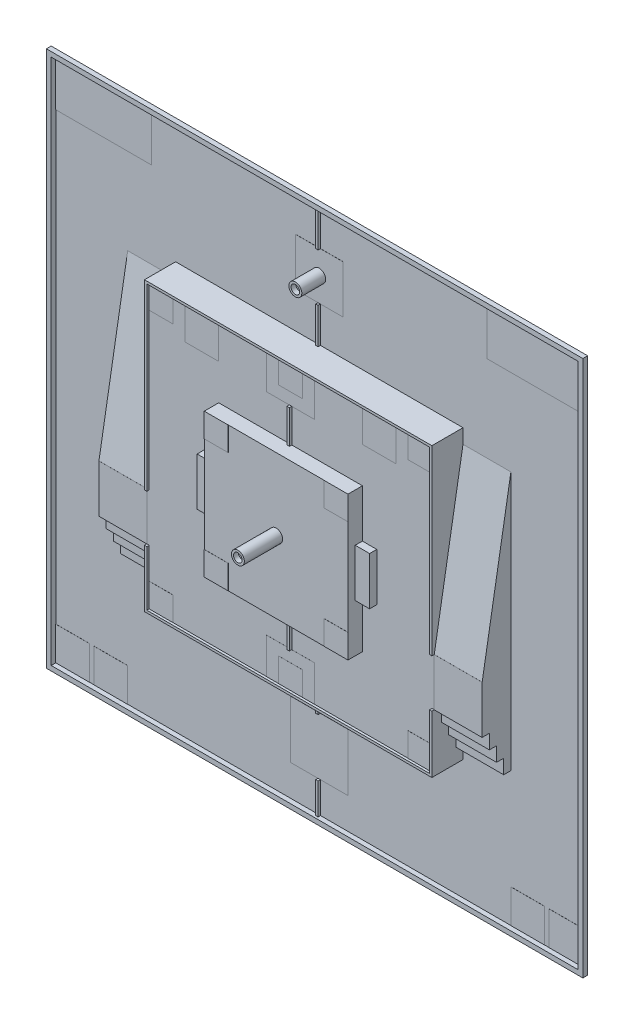
from build123d import *

# Parameters (mm, degrees)
SKETCH_1_W          = 11000
SKETCH_1_H          = 11000
EXTRUDE_1_DEPTH     = 2
SKETCH_2_W          = 700
SKETCH_2_H          = 700
SKETCH_2_W_2        = 2000
SKETCH_2_H_2        = 1000
SKETCH_2_W_3        = 1200
SKETCH_2_H_3        = 1200
SKETCH_2_W_4        = 1000
EXTRUDE_2_DEPTH     = 2
SKETCH_3_W          = 6000
SKETCH_3_H          = 6000
EXTRUDE_3_DEPTH     = 600
EXTRUDE_4_DEPTH     = 1000
SKETCH_5_W          = 3000
SKETCH_5_H          = 3000
EXTRUDE_5_DEPTH     = 300
SKETCH_6_R          = 135
EXTRUDE_6_DEPTH     = 800
SKETCH_7_R          = 90
CUT_EXTRUDE_1_DEPTH = 100
SKETCH_8_W          = 300
SKETCH_8_H          = 1000
EXTRUDE_7_DEPTH     = 150
SKETCH_9_W          = 500
SKETCH_9_H          = 500
EXTRUDE_8_DEPTH     = 2
SKETCH_10_W         = 11200
SKETCH_10_H         = 11200
SKETCH_10_W_2       = 11000
SKETCH_10_H_2       = 11000
EXTRUDE_9_DEPTH     = 100
SKETCH_12_R         = 135
EXTRUDE_10_DEPTH    = 500
SKETCH_13_R         = 90
CUT_EXTRUDE_2_DEPTH = 100
SKETCH_14_W         = 50
SKETCH_14_H         = 650
SKETCH_14_H_2       = 750
EXTRUDE_11_DEPTH    = 50
SKETCH_15_W         = 50
SKETCH_15_H         = 700
EXTRUDE_12_DEPTH    = 50
SKETCH_16_W         = 500
SKETCH_16_H         = 500
SKETCH_16_W_2       = 700
SKETCH_16_H_2       = 700
EXTRUDE_13_DEPTH    = 2
SKETCH_17_W         = 1000
SKETCH_17_H         = 750
EXTRUDE_14_DEPTH    = 1
SKETCH_18_W         = 1000.1
SKETCH_18_H         = 1000.1
EXTRUDE_21_DEPTH    = 1


with BuildPart() as part:
    # ｽｹｯﾁ1 → ﾎﾞｽ - 押し出し1 (new body)
    with BuildSketch(Plane.XY):
        Rectangle(SKETCH_1_W, SKETCH_1_H)
    extrude(amount=EXTRUDE_1_DEPTH)

    # ｽｹｯﾁ2 → ﾎﾞｽ - 押し出し2 (add)
    with BuildSketch(Plane.XY.offset(2)):
        with Locations((-5150, -5150)):
            Rectangle(SKETCH_2_W, SKETCH_2_H)
        with Locations((-4350, -5150)):
            Rectangle(SKETCH_2_W, SKETCH_2_H)
        with Locations((-4500, 5000)):
            Rectangle(SKETCH_2_W_2, SKETCH_2_H_2)
        with Locations((0, -4250)):
            Rectangle(SKETCH_2_W_3, SKETCH_2_H_3)
        with Locations((0, 4250)):
            Rectangle(SKETCH_2_W_4, SKETCH_2_H_2)
        with Locations((4350, -5150)):
            Rectangle(SKETCH_2_W, SKETCH_2_H)
        with Locations((5150, -5150)):
            Rectangle(SKETCH_2_W, SKETCH_2_H)
        with Locations((4500, 5000)):
            Rectangle(SKETCH_2_W_2, SKETCH_2_H_2)
    extrude(amount=EXTRUDE_2_DEPTH)

    # ｽｹｯﾁ3 → ﾎﾞｽ - 押し出し3 (add)
    with BuildSketch(Plane.XY.offset(2)):
        Rectangle(SKETCH_3_W, SKETCH_3_H)
    extrude(amount=EXTRUDE_3_DEPTH)

    # ｽｹｯﾁ4 → ﾎﾞｽ - 押し出し4 (add)
    with BuildSketch(Plane.ZY.offset(3000)):
        Polygon((2, 2700), (2, -2700), (152, -2700), (152, -2400), (302, -2400), (302, -2100), (452, -2100), (452, -1800), (602, -1800), (602, -800), align=None)
    extrude_4 = extrude(amount=EXTRUDE_4_DEPTH)

    # ﾐﾗｰ1: ﾎﾞｽ - 押し出し4 across plane
    add(extrude_4.mirror(Plane(origin=(0, 0, 0), x_dir=(0, 0, 1), z_dir=(1, 0, 0))))

    # ｽｹｯﾁ5 → ﾎﾞｽ - 押し出し5 (add)
    with BuildSketch(Plane.XY.offset(602)):
        Rectangle(SKETCH_5_W, SKETCH_5_H)
    extrude(amount=EXTRUDE_5_DEPTH)

    # ｽｹｯﾁ6 → ﾎﾞｽ - 押し出し6 (add)
    with BuildSketch(Plane.XY.offset(902)):
        Circle(SKETCH_6_R)
    extrude(amount=EXTRUDE_6_DEPTH)

    # ｽｹｯﾁ7 → ｶｯﾄ - 押し出し1 (cut)
    with BuildSketch(Plane.XY.offset(1702)):
        Circle(SKETCH_7_R)
    extrude(amount=-CUT_EXTRUDE_1_DEPTH, mode=Mode.SUBTRACT)

    # ｽｹｯﾁ8 → ﾎﾞｽ - 押し出し7 (add)
    with BuildSketch(Plane.XY.offset(602)):
        with Locations((1650, 0)):
            Rectangle(SKETCH_8_W, SKETCH_8_H)
        with Locations((-1650, 0)):
            Rectangle(SKETCH_8_W, SKETCH_8_H)
    extrude(amount=EXTRUDE_7_DEPTH)

    # ｽｹｯﾁ9 → ﾎﾞｽ - 押し出し8 (add)
    with BuildSketch(Plane.XY.offset(902)):
        with Locations((1250, 1250)):
            Rectangle(SKETCH_9_W, SKETCH_9_H)
        with Locations((-1250, 1250)):
            Rectangle(SKETCH_9_W, SKETCH_9_H)
        with Locations((1250, -1250)):
            Rectangle(SKETCH_9_W, SKETCH_9_H)
        with Locations((-1250, -1250)):
            Rectangle(SKETCH_9_W, SKETCH_9_H)
    extrude(amount=EXTRUDE_8_DEPTH)



with BuildPart() as body_2:
    # ｽｹｯﾁ10 → ﾎﾞｽ - 押し出し9 (new body)
    with BuildSketch(Plane(origin=(0, 0, 0), x_dir=(-1, 0, 0), z_dir=(0, 0, -1))):
        Rectangle(SKETCH_10_W, SKETCH_10_H)
        Rectangle(SKETCH_10_W_2, SKETCH_10_H_2, mode=Mode.SUBTRACT)
    extrude(amount=-EXTRUDE_9_DEPTH)


with BuildPart() as part_1:
    add(part.part)

    add(body_2.part)  # ﾎﾞｽ - 押し出し10 merges body 2
    # ｽｹｯﾁ12 → ﾎﾞｽ - 押し出し10 (add)
    with BuildSketch(Plane.XY.offset(2)):
        with Locations((0, 4250)):
            Circle(SKETCH_12_R)
    extrude(amount=EXTRUDE_10_DEPTH)

    # ｽｹｯﾁ13 → ｶｯﾄ - 押し出し2 (cut)
    with BuildSketch(Plane.XY.offset(502)):
        with Locations((0, 4250)):
            Circle(SKETCH_13_R)
    extrude(amount=-CUT_EXTRUDE_2_DEPTH, mode=Mode.SUBTRACT)

    # ｽｹｯﾁ14 → ﾎﾞｽ - 押し出し11 (add)
    with BuildSketch(Plane.XY.offset(2)):
        with Locations((0, -3325)):
            Rectangle(SKETCH_14_W, SKETCH_14_H)
        with Locations((0, -5175)):
            Rectangle(SKETCH_14_W, SKETCH_14_H)
        with Locations((0, 3375)):
            Rectangle(SKETCH_14_W, SKETCH_14_H_2)
        with Locations((0, 5125)):
            Rectangle(SKETCH_14_W, SKETCH_14_H_2)
    extrude(amount=EXTRUDE_11_DEPTH)

    # ｽｹｯﾁ15 → ﾎﾞｽ - 押し出し12 (add)
    with BuildSketch(Plane.XY.offset(602)):
        Polygon((-3000, -800), (-3000, 3000), (3000, 3000), (3000, -800), (2950, -800), (2950, 2950), (-2950, 2950), (-2950, -800), align=None)
        Polygon((-3000, -1800), (-3000, -3000), (3000, -3000), (3000, -1800), (2950, -1800), (2950, -2950), (-2950, -2950), (-2950, -1800), align=None)
        with Locations((0, 1850)):
            Rectangle(SKETCH_15_W, SKETCH_15_H)
        with Locations((0, -1850)):
            Rectangle(SKETCH_15_W, SKETCH_15_H)
    extrude(amount=EXTRUDE_12_DEPTH)

    # ｽｹｯﾁ16 → ﾎﾞｽ - 押し出し13 (add)
    with BuildSketch(Plane.XY.offset(602)):
        with Locations((2700, -2700)):
            Rectangle(SKETCH_16_W, SKETCH_16_H)
        with Locations((-2700, -2700)):
            Rectangle(SKETCH_16_W, SKETCH_16_H)
        with Locations((2700, 2700)):
            Rectangle(SKETCH_16_W, SKETCH_16_H)
        with Locations((-2700, 2700)):
            Rectangle(SKETCH_16_W, SKETCH_16_H)
        with Locations((0, -2700)):
            Rectangle(SKETCH_16_W, SKETCH_16_H)
        with Locations((0, 2700)):
            Rectangle(SKETCH_16_W, SKETCH_16_H)
        with Locations((1850, 2600)):
            Rectangle(SKETCH_16_W_2, SKETCH_16_H_2)
        with Locations((-1850, 2600)):
            Rectangle(SKETCH_16_W_2, SKETCH_16_H_2)
    extrude(amount=EXTRUDE_13_DEPTH)

    # ｽｹｯﾁ17 → ﾎﾞｽ - 押し出し14 (add)
    with BuildSketch(Plane.XY.offset(602)):
        with Locations((0, 2575)):
            Rectangle(SKETCH_17_W, SKETCH_17_H)
        with Locations((0, -2575)):
            Rectangle(SKETCH_17_W, SKETCH_17_H)
    extrude(amount=EXTRUDE_14_DEPTH)

    # ｽｹｯﾁ18 → ﾎﾞｽ - 押し出し21 (add)
    with BuildSketch(Plane.XY.offset(602)):
        with Locations((-3499.95, -1300.05)):
            Rectangle(SKETCH_18_W, SKETCH_18_H)
        with Locations((3499.95, -1300.05)):
            Rectangle(SKETCH_18_W, SKETCH_18_H)
    extrude(amount=EXTRUDE_21_DEPTH)


solid = part_1.part
